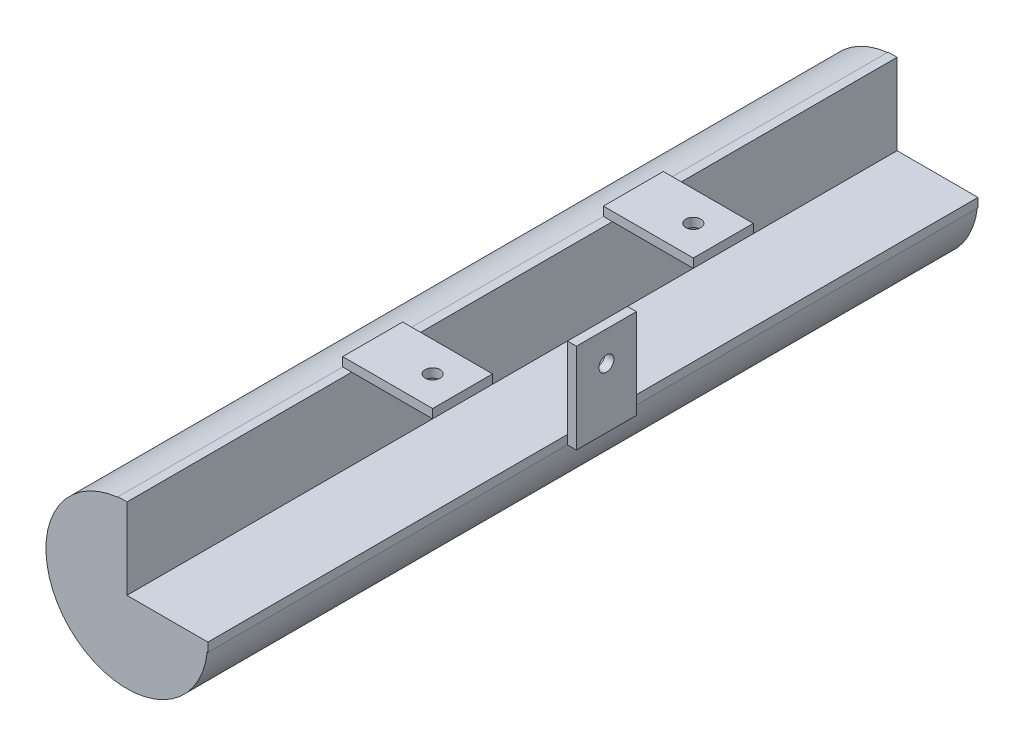
from build123d import *

# Parameters (mm, degrees)
BOSS_EXTRUDE1_DEPTH = 128.5
SKETCH7_W           = 30
SKETCH7_H           = 20
BOSS_EXTRUDE4_DEPTH = 3
CUT_EXTRUDE1_REACH  = 145.152
SKETCH9_R           = 2.5
SKETCH10_W          = 20
SKETCH10_H          = 30
BOSS_EXTRUDE5_DEPTH = 3
CUT_EXTRUDE2_REACH  = 145.753
SKETCH11_R          = 2.5


with BuildPart() as part:
    # Sketch4 → Boss-Extrude1 (new, symmetric)
    with BuildSketch(Plane.XY):
        with BuildLine():
            Line((0, 0), (27, 0))
            Line((27, 0), (27, -3))
            Line((27, -3), (26.800082477, -3))
            ThreePointArc((26.800082477, -3), (-19.135504983, -19.08508544), (-3, 26.83281573))
            Line((-3, 26.83281573), (-3, 27))
            Line((-3, 27), (0, 27))
            Line((0, 27), (0, 0))
        make_face()
    extrude(amount=BOSS_EXTRUDE1_DEPTH, both=True)

    # Sketch7 → Boss-Extrude4 (add)
    with BuildSketch(Plane(origin=(0, 27, 0), x_dir=(1, 0, 0), z_dir=(0, 1, 0))):
        with Locations((12, -43.5)):
            Rectangle(SKETCH7_W, SKETCH7_H)
        with Locations((12, 43.5)):
            Rectangle(SKETCH7_W, SKETCH7_H)
    extrude(amount=BOSS_EXTRUDE4_DEPTH)

    # Sketch9 → Cut-Extrude1 (cut, up to next)
    with BuildSketch(Plane(origin=(0, 30, 0), x_dir=(1, 0, 0), z_dir=(0, 1, 0)), mode=Mode.PRIVATE) as cut_extrude1_sk1:
        with Locations(Location((17, -43.5, 0), (0, 0, 270))):
            Circle(SKETCH9_R)
    cut_extrude1_tool1 = extrude(cut_extrude1_sk1.sketch, amount=-CUT_EXTRUDE1_REACH, mode=Mode.PRIVATE) & part.part
    # Sketch9 → Cut-Extrude1 (cut, up to next)
    with BuildSketch(Plane(origin=(0, 30, 0), x_dir=(1, 0, 0), z_dir=(0, 1, 0)), mode=Mode.PRIVATE) as cut_extrude1_sk2:
        with Locations(Location((17, 43.5, 0), (0, 0, 270))):
            Circle(SKETCH9_R)
    cut_extrude1_tool2 = extrude(cut_extrude1_sk2.sketch, amount=-CUT_EXTRUDE1_REACH, mode=Mode.PRIVATE) & part.part
    add(cut_extrude1_tool1.solids().sort_by_distance((17, 30, 43.5))[0], mode=Mode.SUBTRACT)
    add(cut_extrude1_tool2.solids().sort_by_distance((17, 30, -43.5))[0], mode=Mode.SUBTRACT)

    # Sketch10 → Boss-Extrude5 (add)
    with BuildSketch(Plane(origin=(27, 0, 0), x_dir=(0, 0, -1), z_dir=(1, 0, 0))):
        with Locations((1.5, 12)):
            Rectangle(SKETCH10_W, SKETCH10_H)
    extrude(amount=BOSS_EXTRUDE5_DEPTH)

    # Sketch11 → Cut-Extrude2 (cut, up to next)
    with BuildSketch(Plane(origin=(30, 0, 0), x_dir=(0, 0, -1), z_dir=(1, 0, 0)), mode=Mode.PRIVATE) as cut_extrude2_sk1:
        with Locations((1.5, 17)):
            Circle(SKETCH11_R)
    cut_extrude2_tool1 = extrude(cut_extrude2_sk1.sketch, amount=-CUT_EXTRUDE2_REACH, mode=Mode.PRIVATE) & part.part
    add(cut_extrude2_tool1.solids().sort_by_distance((30, 17, -1.5))[0], mode=Mode.SUBTRACT)


solid = part.part
